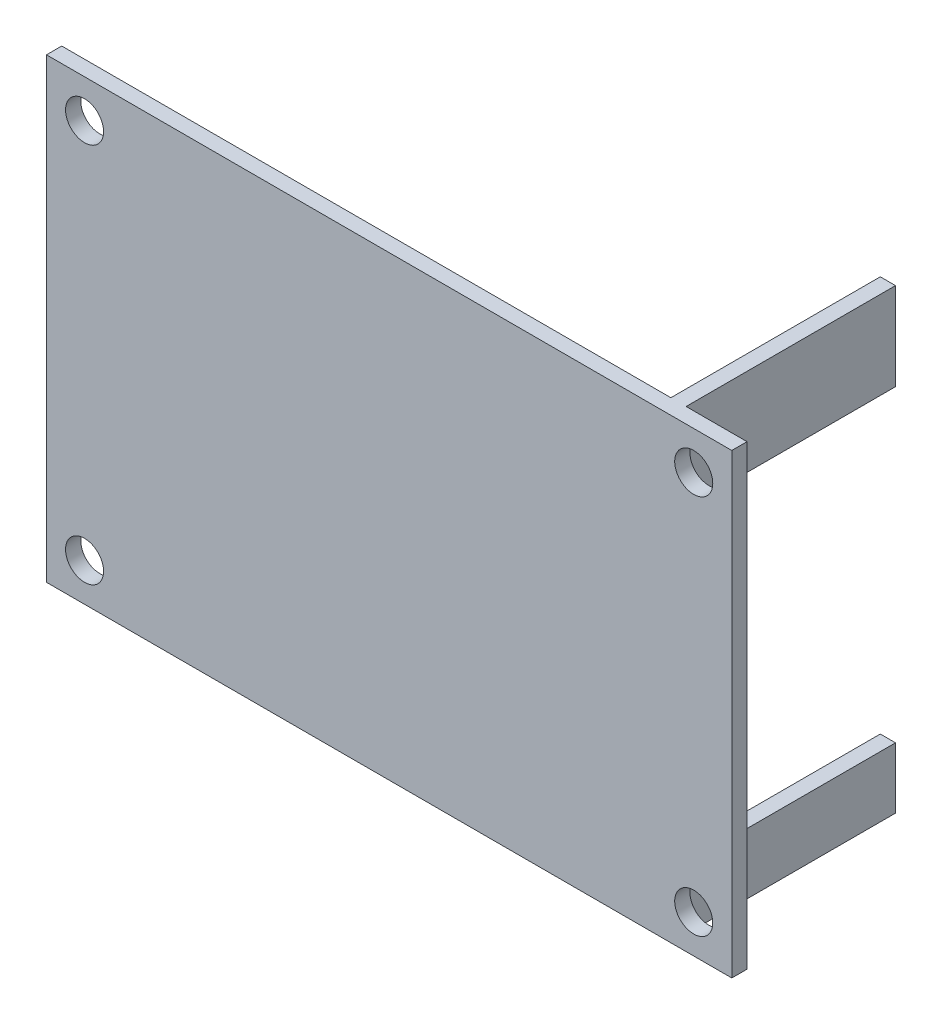
from build123d import *

# Parameters (mm, degrees)
SKETCH1_W           = 90
SKETCH1_H           = 60
BOSS_EXTRUDE1_DEPTH = 2
SKETCH2_R           = 2.5
CUT_EXTRUDE1_DEPTH  = 10
SKETCH3_W           = 2
SKETCH3_H           = 60
BOSS_EXTRUDE4_DEPTH = 27.5
SKETCH4_W           = 20
SKETCH4_H           = 40.5
CUT_EXTRUDE2_DEPTH  = 10


with BuildPart() as part:
    # Sketch1 → Boss-Extrude1 (new body)
    with BuildSketch(Plane.XY):
        Rectangle(SKETCH1_W, SKETCH1_H)
    extrude(amount=BOSS_EXTRUDE1_DEPTH)

    # Sketch2 → Cut-Extrude1 (cut)
    with BuildSketch(Plane.XY.offset(2)):
        with Locations((-40, -25)):
            Circle(SKETCH2_R)
        with Locations((-40, 25)):
            Circle(SKETCH2_R)
        with Locations((40, 25)):
            Circle(SKETCH2_R)
        with Locations((40, -25)):
            Circle(SKETCH2_R)
    extrude(amount=-CUT_EXTRUDE1_DEPTH, mode=Mode.SUBTRACT)

    # Sketch3 → Boss-Extrude4 (add)
    with BuildSketch(Plane(origin=(0, 0, 0), x_dir=(-1, 0, 0), z_dir=(0, 0, -1))):
        with Locations((-36, 0)):
            Rectangle(SKETCH3_W, SKETCH3_H)
    extrude(amount=BOSS_EXTRUDE4_DEPTH)

    # Sketch4 → Cut-Extrude2 (cut)
    with BuildSketch(Plane(origin=(37, 0, 0), x_dir=(0, 0, -1), z_dir=(1, 0, 0))):
        with Locations((17.5, -1.75)):
            Rectangle(SKETCH4_W, SKETCH4_H)
    extrude(amount=-CUT_EXTRUDE2_DEPTH, mode=Mode.SUBTRACT)


solid = part.part
